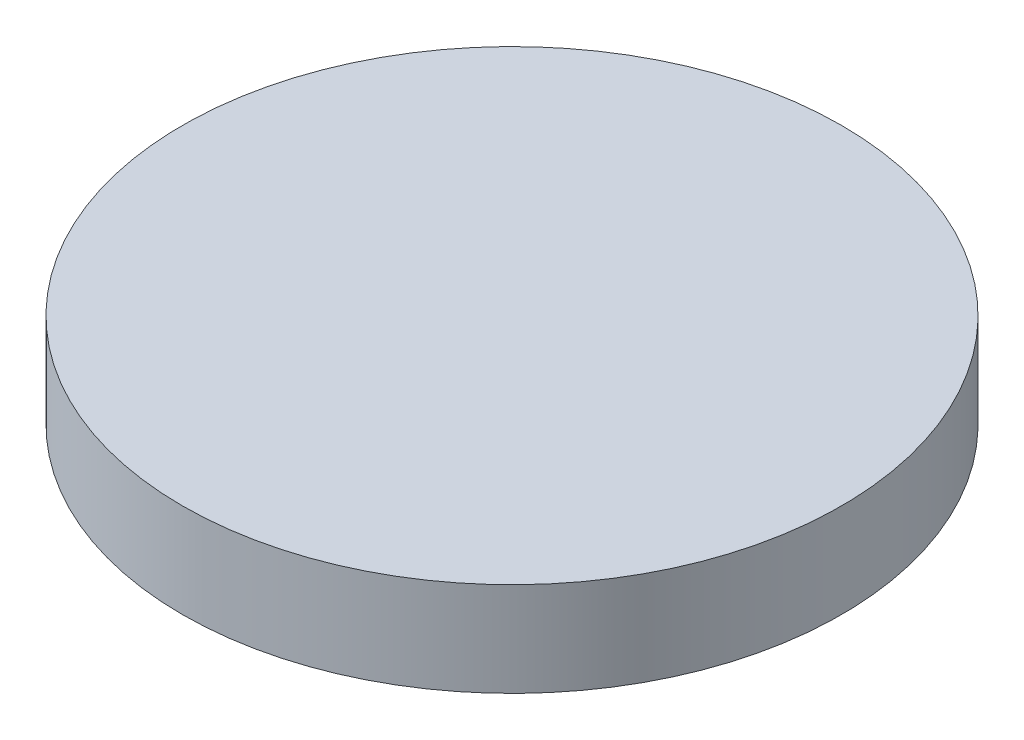
from build123d import *

# Parameters (mm, degrees)
SKETCH1_R           = 7
BOSS_EXTRUDE1_DEPTH = 2


with BuildPart() as part:
    # Sketch1 → Boss-Extrude1 (new body)
    with BuildSketch(Plane(origin=(0, 0, 0), x_dir=(1, 0, 0), z_dir=(0, 1, 0))):
        with Locations(Location((0, 0, 0), (0, 0, 270))):
            Circle(SKETCH1_R)
    extrude(amount=BOSS_EXTRUDE1_DEPTH)


solid = part.part
